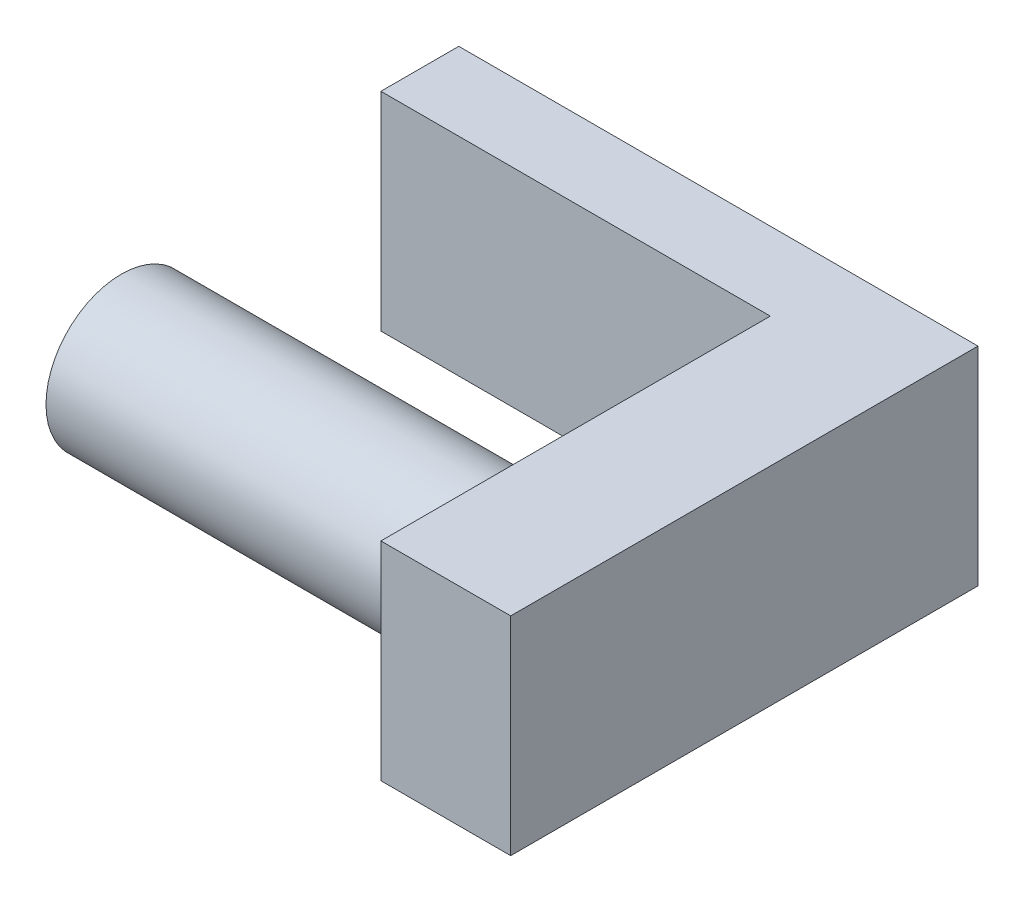
from build123d import *

# Parameters (mm, degrees)
ESQUISSE1_W        = 20
ESQUISSE1_H        = 8
BOSS_EXTRU_1_DEPTH = 3
ESQUISSE2_W        = 5
ESQUISSE2_H        = 8
BOSS_EXTRU_2_DEPTH = 15
ESQUISSE3_R        = 2.9
BOSS_EXTRU_3_DEPTH = 15


with BuildPart() as part:
    # Esquisse1 → Boss.-Extru.1 (new body)
    with BuildSketch(Plane.XY):
        with Locations((10, 4)):
            Rectangle(ESQUISSE1_W, ESQUISSE1_H)
    extrude(amount=BOSS_EXTRU_1_DEPTH)

    # Esquisse2 → Boss.-Extru.2 (add)
    with BuildSketch(Plane.XY.offset(3)):
        with Locations((17.5, 4)):
            Rectangle(ESQUISSE2_W, ESQUISSE2_H)
    extrude(amount=BOSS_EXTRU_2_DEPTH)

    # Esquisse3 → Boss.-Extru.3 (add)
    with BuildSketch(Plane.ZY.offset(-15)):
        with Locations(Location((13, 4, 0), (0, 0, 90))):
            Circle(ESQUISSE3_R)
    extrude(amount=BOSS_EXTRU_3_DEPTH)


solid = part.part
